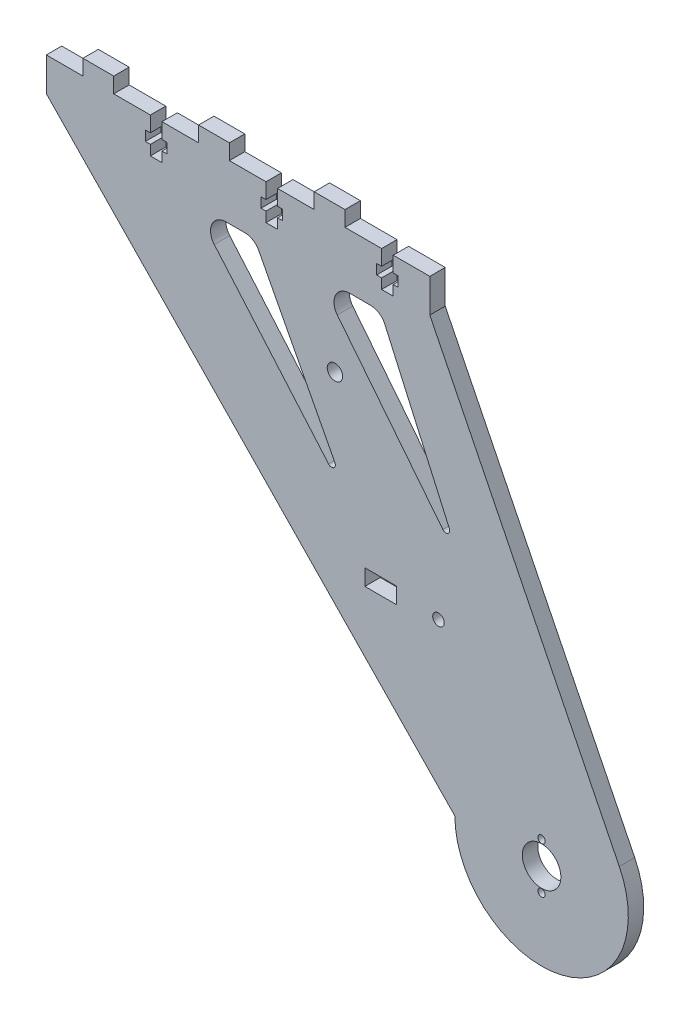
from build123d import *

# Parameters (mm, degrees)
SKETCH_1_R      = 2
SKETCH_1_R_2    = 1.5
SKETCH_1_R_3    = 5
SKETCH_1_R_4    = 0.95
SKETCH_1_W      = 8.2
SKETCH_1_H      = 4.2
EXTRUDE_1_DEPTH = 4
FILLET_1_R      = 4
FILLET_2_R      = 1


with BuildPart() as part:
    # 草图1 → 凸台-拉伸1 (new body)
    with BuildSketch(Plane.XY):
        with BuildLine():
            Line((-38.15, 66.25), (-38.15, 62.25))
            Line((-38.15, 62.25), (-39.45, 62.25))
            Line((-39.45, 62.25), (-39.45, 59.65))
            Line((-39.45, 59.65), (-38.15, 59.65))
            Line((-38.15, 59.65), (-38.15, 57.05))
            Line((-38.15, 57.05), (-35.15, 57.05))
            Line((-35.15, 57.05), (-35.15, 59.65))
            Line((-35.15, 59.65), (-33.85, 59.65))
            Line((-33.85, 59.65), (-33.85, 62.25))
            Line((-33.85, 62.25), (-35.15, 62.25))
            Line((-35.15, 62.25), (-35.15, 66.25))
            Line((-35.15, 66.25), (-25.65, 66.25))
            Line((-25.65, 66.25), (-25.65, 70.25))
            Line((-25.65, 70.25), (-17.65, 70.25))
            Line((-17.65, 70.25), (-17.65, 66.25))
            Line((-17.65, 66.25), (-8.15, 66.25))
            Line((-8.15, 66.25), (-8.15, 62.25))
            Line((-8.15, 62.25), (-9.45, 62.25))
            Line((-9.45, 62.25), (-9.45, 59.65))
            Line((-9.45, 59.65), (-8.15, 59.65))
            Line((-8.15, 59.65), (-8.15, 57.05))
            Line((-8.15, 57.05), (-5.15, 57.05))
            Line((-5.15, 57.05), (-5.15, 59.65))
            Line((-5.15, 59.65), (-3.85, 59.65))
            Line((-3.85, 59.65), (-3.85, 62.25))
            Line((-3.85, 62.25), (-5.15, 62.25))
            Line((-5.15, 62.25), (-5.15, 66.25))
            Line((-5.15, 66.25), (4.35, 66.25))
            Line((4.35, 66.25), (4.35, 57.55))
            Line((4.35, 57.55), (53.51460577, -41.768082641))
            ThreePointArc((53.51460577, -41.768082641), (38.475737517, -73.658373169), (10.85, -51.75))
            Line((10.85, -51.75), (-95.15, 57.55))
            Line((-95.15, 57.55), (-95.15, 66.25))
            Line((-95.15, 66.25), (-85.65, 66.25))
            Line((-85.65, 66.25), (-85.65, 70.25))
            Line((-85.65, 70.25), (-77.65, 70.25))
            Line((-77.65, 70.25), (-77.65, 66.25))
            Line((-77.65, 66.25), (-68.15, 66.25))
            Line((-68.15, 66.25), (-68.15, 62.25))
            Line((-68.15, 62.25), (-69.45, 62.25))
            Line((-69.45, 62.25), (-69.45, 59.65))
            Line((-69.45, 59.65), (-68.15, 59.65))
            Line((-68.15, 59.65), (-68.15, 57.05))
            Line((-68.15, 57.05), (-65.15, 57.05))
            Line((-65.15, 57.05), (-65.15, 59.65))
            Line((-65.15, 59.65), (-63.85, 59.65))
            Line((-63.85, 59.65), (-63.85, 62.25))
            Line((-63.85, 62.25), (-65.15, 62.25))
            Line((-65.15, 62.25), (-65.15, 66.25))
            Line((-65.15, 66.25), (-55.65, 66.25))
            Line((-55.65, 66.25), (-55.65, 70.25))
            Line((-55.65, 70.25), (-47.65, 70.25))
            Line((-47.65, 70.25), (-47.65, 66.25))
            Line((-47.65, 66.25), (-38.15, 66.25))
        make_face()
        with Locations((-20.262745434, 32.422010331)):
            Circle(SKETCH_1_R, mode=Mode.SUBTRACT)
        with Locations((6.598407643, -9.75)):
            Circle(SKETCH_1_R_2, mode=Mode.SUBTRACT)
        with Locations((33.35, -51.75)):
            Circle(SKETCH_1_R_3, mode=Mode.SUBTRACT)
        with Locations((33.35, -45.75)):
            Circle(SKETCH_1_R_4, mode=Mode.SUBTRACT)
        with Locations((33.35, -57.75)):
            Circle(SKETCH_1_R_4, mode=Mode.SUBTRACT)
        with Locations((-8.401592357, -9.75)):
            Rectangle(SKETCH_1_W, SKETCH_1_H, mode=Mode.SUBTRACT)
        Polygon((-57.254487093, 52.05), (-41.177109745, 52.05), (-16.214099548, 4.334114018), align=None, mode=Mode.SUBTRACT)
        Polygon((12.65644769, 4.86329261), (-24.797659566, 52.05), (-8.394400914, 52.05), align=None, mode=Mode.SUBTRACT)
    extrude(amount=EXTRUDE_1_DEPTH)

    # 圆角1
    fillet_1_edges = [part.edges().sort_by_distance(p)[0] for p in [
        (-57.254487093, 52.05, 2),
        (-41.177109745, 52.05, 2),
        (-8.394400914, 52.05, 2),
        (-24.797659566, 52.05, 2),
    ]]
    fillet(fillet_1_edges, radius=FILLET_1_R)

    # 圆角2
    fillet_2_edges = [part.edges().sort_by_distance(p)[0] for p in [
        (-16.214099548, 4.334114018, 2),
        (12.65644769, 4.86329261, 2),
    ]]
    fillet(fillet_2_edges, radius=FILLET_2_R)


solid = part.part
